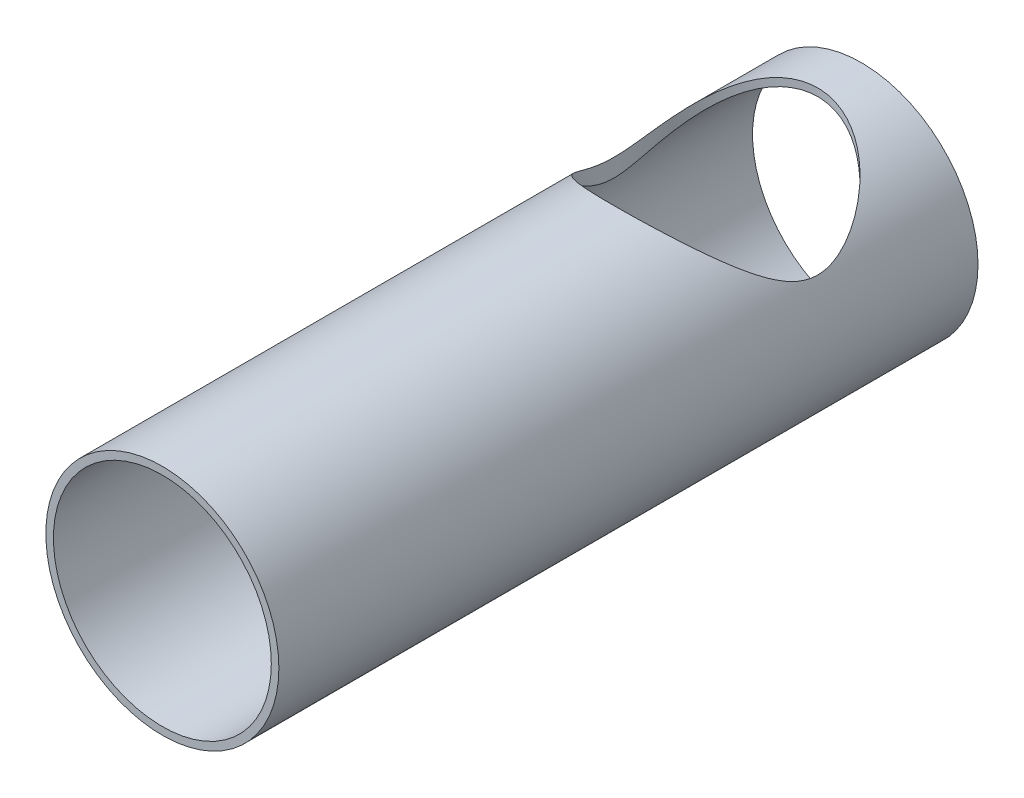
from build123d import *

# Parameters (mm, degrees)
SKETCH1_R           = 25.4
SKETCH1_R_2         = 23.749
BOSS_EXTRUDE1_DEPTH = 152.4
SKETCH2_R           = 22.225
CUT_EXTRUDE2_DEPTH  = 22.86


with BuildPart() as part:
    # Sketch1 → Boss-Extrude1 (new body)
    with BuildSketch(Plane.XY):
        with Locations(Location((0, 0, 0), (0, 0, 180))):
            Circle(SKETCH1_R)
        with Locations(Location((0, 0, 0), (0, 0, 180))):
            Circle(SKETCH1_R_2, mode=Mode.SUBTRACT)
    extrude(amount=BOSS_EXTRUDE1_DEPTH)

    # Sketch2 → Cut-Extrude2 (cut)
    with BuildSketch(Plane(origin=(0, 25.4, 0), x_dir=(-1, 0, 0), z_dir=(0, 1, 0))):
        with Locations(Location((0, 31.75, 0), (0, 0, 90))):
            Circle(SKETCH2_R)
    extrude(amount=-CUT_EXTRUDE2_DEPTH, mode=Mode.SUBTRACT)


solid = part.part
